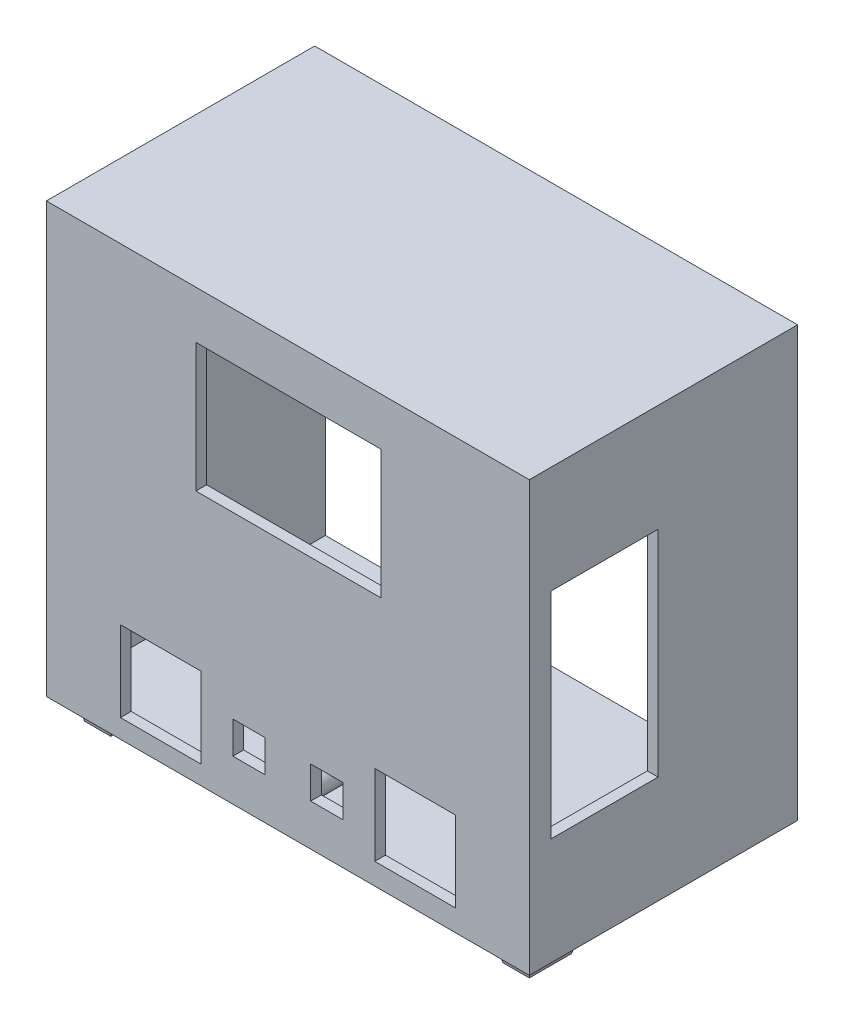
from build123d import *

# Parameters (mm, degrees)
SKETCH1_W                                      = 90
SKETCH1_H                                      = 80
BOSS_EXTRUDE1_DEPTH                            = 50
SHELL1_T                                       = -2
SKETCH2_W                                      = 34.5
SKETCH2_H                                      = 24
CUT_EXTRUDE_DEPTH                              = 2
SKETCH3_W                                      = 15
SKETCH3_H                                      = 15
SKETCH3_W_2                                    = 6
SKETCH3_H_2                                    = 6
CUT_EXTRUDE2_DEPTH                             = 2
SKETCH4_R                                      = 2
BOSS_EXTRUDE3_DEPTH                            = 10
SKETCH7_W                                      = 7
SKETCH7_H                                      = 10
BOSS_EXTRUDE4_DEPTH                            = 4
BOSS_EXTRUDE4_DRAFT                            = 15
BOSS_EXTRUDE4_PROFILE_2_DEPTH                  = 4
BOSS_EXTRUDE4_PROFILE_2_DRAFT                  = 15
SKETCH11_W                                     = 8
SKETCH11_H                                     = 12
CUT_EXTRUDE3_DEPTH                             = 10
SKETCH12_W                                     = 20
SKETCH12_H                                     = 40
CUT_EXTRUDE4_DEPTH                             = 10
CSK_FOR_M3_OVAL_HEAD_MACHINE_SCREW1_AT_2_COUNT = 2
CSK_FOR_M3_OVAL_HEAD_MACHINE_SCREW1_AT_2_PITCH = 66.030296077
CSK_FOR_M3_OVAL_HEAD_MACHINE_SCREW1_AT_3_COUNT = 2
CSK_FOR_M3_OVAL_HEAD_MACHINE_SCREW1_AT_3_PITCH = 72.672209269


with BuildPart() as part:
    # Sketch1 → Boss-Extrude1 (new body)
    with BuildSketch(Plane.XY):
        Rectangle(SKETCH1_W, SKETCH1_H)
    extrude(amount=BOSS_EXTRUDE1_DEPTH)

    # Shell1
    shell1_openings = [part.faces().sort_by_distance(p)[0] for p in [
        (0, 0, 0),
    ]]
    offset(amount=SHELL1_T, openings=shell1_openings, kind=Kind.INTERSECTION)

    # Sketch2 → Cut-Extrude (cut)
    with BuildSketch(Plane.XY.offset(50)):
        with Locations((0.11, 19.1)):
            Rectangle(SKETCH2_W, SKETCH2_H)
    extrude(amount=-CUT_EXTRUDE_DEPTH, mode=Mode.SUBTRACT)

    # Sketch3 → Cut-Extrude2 (cut)
    with BuildSketch(Plane.XY.offset(50)):
        with Locations((23.7, -28.5)):
            Rectangle(SKETCH3_W, SKETCH3_H)
        with Locations((-23.7, -29)):
            Rectangle(SKETCH3_W, SKETCH3_H)
        with Locations((-7.25, -29.25)):
            Rectangle(SKETCH3_W_2, SKETCH3_H_2)
        with Locations((7.25, -29.25)):
            Rectangle(SKETCH3_W_2, SKETCH3_H_2)
    extrude(amount=-CUT_EXTRUDE2_DEPTH, mode=Mode.SUBTRACT)

    # Sketch4 → Boss-Extrude3 (add)
    with BuildSketch(Plane(origin=(0, 0, 48), x_dir=(-1, 0, 0), z_dir=(0, 0, -1))):
        with Locations((-34.5, -35)):
            Circle(SKETCH4_R)
        with Locations((0, -34)):
            Circle(SKETCH4_R)
        with Locations((-32.5, 31)):
            Circle(SKETCH4_R)
    extrude(amount=BOSS_EXTRUDE3_DEPTH)


with BuildPart() as boss_extrude4_tool:
    # Sketch7 → Boss-Extrude4 (with draft: the straight prism first)
    with BuildSketch(Plane.XZ.offset(40)):
        with Locations((-39, 42.5)):
            Rectangle(SKETCH7_W, SKETCH7_H)
    extrude(amount=BOSS_EXTRUDE4_DEPTH)
    # Boss-Extrude4: the draft: its side faces are tilted about the plane it starts from
    boss_extrude4_sides = [boss_extrude4_tool.faces().sort_by_distance(p)[0] for p in [
        (-42.5, -42, 42.5),
        (-39, -42, 37.5),
        (-35.5, -42, 42.5),
        (-39, -42, 47.5),
    ]]
    draft(boss_extrude4_sides, Plane.XZ.offset(40), BOSS_EXTRUDE4_DRAFT)


with BuildPart() as part_1:
    add(part.part)

    # Boss-Extrude4: add boss_extrude4_tool
    add(boss_extrude4_tool.part)


with BuildPart() as boss_extrude4_profile_2_tool:
    # Sketch7 → Boss-Extrude4 profile 2 (with draft: the straight prism first)
    with BuildSketch(Plane.XZ.offset(40)):
        with Locations((39, 42.5)):
            Rectangle(SKETCH7_W, SKETCH7_H)
    extrude(amount=BOSS_EXTRUDE4_PROFILE_2_DEPTH)
    # Boss-Extrude4 profile 2: the draft: its side faces are tilted about the plane it starts from
    boss_extrude4_profile_2_sides = [boss_extrude4_profile_2_tool.faces().sort_by_distance(p)[0] for p in [
        (35.5, -42, 42.5),
        (39, -42, 37.5),
        (42.5, -42, 42.5),
        (39, -42, 47.5),
    ]]
    draft(boss_extrude4_profile_2_sides, Plane.XZ.offset(40), BOSS_EXTRUDE4_PROFILE_2_DRAFT)


with BuildPart() as part_2:
    add(part_1.part)

    # Boss-Extrude4 profile 2: add boss_extrude4_profile_2_tool
    add(boss_extrude4_profile_2_tool.part)

    # Sketch11 → Cut-Extrude3 (cut)
    with BuildSketch(Plane.ZY.offset(45)):
        with Locations((41, -9)):
            Rectangle(SKETCH11_W, SKETCH11_H)
    extrude(amount=-CUT_EXTRUDE3_DEPTH, mode=Mode.SUBTRACT)

    # Sketch12 → Cut-Extrude4 (cut)
    with BuildSketch(Plane(origin=(45, 0, 0), x_dir=(0, 0, -1), z_dir=(1, 0, 0))):
        with Locations((-36, 0)):
            Rectangle(SKETCH12_W, SKETCH12_H)
    extrude(amount=-CUT_EXTRUDE4_DEPTH, mode=Mode.SUBTRACT)

    # Sketch14 → CSK for M3 Oval Head Machine Screw1 (revolve, cut)
    with BuildSketch(Plane(origin=(32.5, 31, 38), x_dir=(0, 1, 0), z_dir=(1, 0, 0))):
        Polygon((0, 0), (0, 11.021463052), (1.7, 10), (1.7, 1.45), (3.15, 0), align=None)
    csk_for_m3_oval_head_machine_screw1 = revolve(axis=Axis((32.5, 31, 31.65), (0, 0, 1)), mode=Mode.SUBTRACT)

    # CSK for M3 Oval Head Machine Screw1 at 2: CSK for M3 Oval Head Machine Screw1 ×2
    with Locations(*[Vector(0.030289126640769028, -0.9995411791453814, 0) * (i * CSK_FOR_M3_OVAL_HEAD_MACHINE_SCREW1_AT_2_PITCH) for i in range(1, CSK_FOR_M3_OVAL_HEAD_MACHINE_SCREW1_AT_2_COUNT)]):
        add(csk_for_m3_oval_head_machine_screw1, mode=Mode.SUBTRACT)

    # CSK for M3 Oval Head Machine Screw1 at 3: CSK for M3 Oval Head Machine Screw1 ×2
    with Locations(*[Vector(-0.447213595499958, -0.894427190999916, 0) * (i * CSK_FOR_M3_OVAL_HEAD_MACHINE_SCREW1_AT_3_PITCH) for i in range(1, CSK_FOR_M3_OVAL_HEAD_MACHINE_SCREW1_AT_3_COUNT)]):
        add(csk_for_m3_oval_head_machine_screw1, mode=Mode.SUBTRACT)


solid = part_2.part
